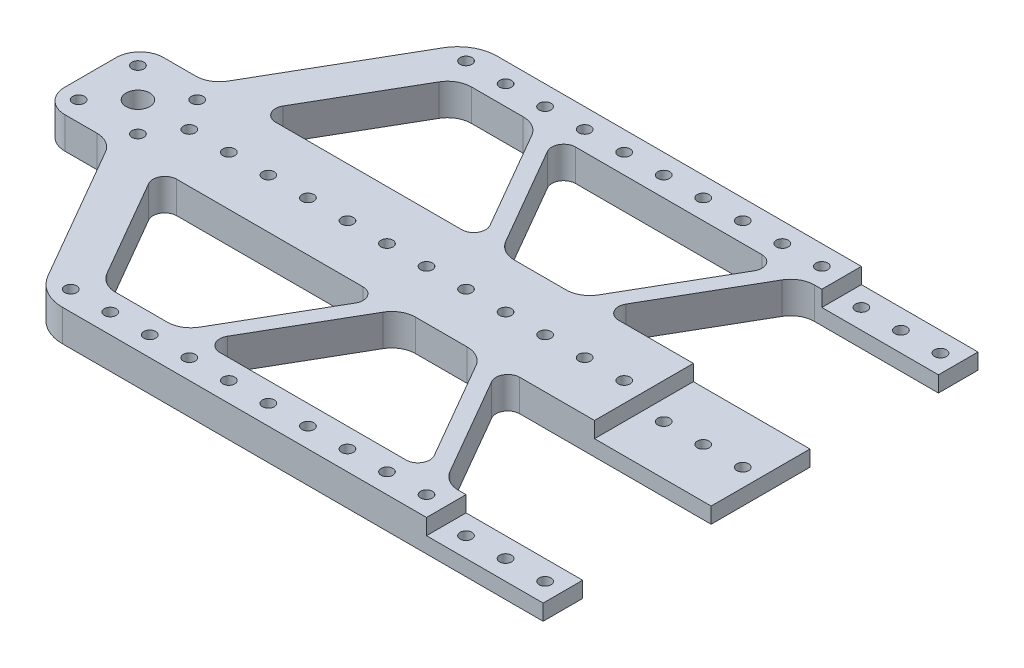
from build123d import *

# Parameters (mm, degrees)
SKETCH1_R           = 1.5
SKETCH1_R_2         = 3
BOSS_EXTRUDE1_DEPTH = 4
BOSS_EXTRUDE2_START = 4
SKETCH1_4_R         = 1.5
SKETCH1_4_R_2       = 3
BOSS_EXTRUDE2_DEPTH = 4
FILLET1_R           = 6
FILLET2_R           = 6
FILLET3_R           = 3
FILLET4_R           = 10


with BuildPart() as part:
    # Sketch1 → Boss-Extrude1 (new body)
    with BuildSketch(Plane(origin=(0, 0, 0), x_dir=(1, 0, 0), z_dir=(0, 1, 0))):
        Polygon((-84.75, 12.5), (-84.75, -12.5), (-67.174137787, -12.5), (-42.636751346, -55), (84.75, -55), (84.75, -45), (49.90212315, -45), (31.138239402, -12.5), (84.75, -12.5), (84.75, 12.5), (31.138239402, 12.5), (49.90212315, 45), (84.75, 45), (84.75, 55), (-42.636751346, 55), (-67.174137787, 12.5), align=None)
        Polygon((1.900635095, 12.5), (-55.627132403, 12.5), (-36.863248654, 45), (-16.863248654, 45), align=None, mode=Mode.SUBTRACT)
        Polygon((26.519437248, 12.5), (6.519437248, 12.5), (-12.244446501, 45), (45.283320997, 45), align=None, mode=Mode.SUBTRACT)
        Polygon((6.519437248, -12.5), (26.519437248, -12.5), (45.283320997, -45), (-12.244446501, -45), align=None, mode=Mode.SUBTRACT)
        Polygon((-55.627132403, -12.5), (1.900635095, -12.5), (-16.863248654, -45), (-36.863248654, -45), align=None, mode=Mode.SUBTRACT)
        with Locations((-80.25, -7.5)):
            Circle(SKETCH1_R, mode=Mode.SUBTRACT)
        with Locations((-65.25, -7.5)):
            Circle(SKETCH1_R, mode=Mode.SUBTRACT)
        with Locations((-59.75, 0)):
            Circle(SKETCH1_R, mode=Mode.SUBTRACT)
        with Locations((-49.75, 0)):
            Circle(SKETCH1_R, mode=Mode.SUBTRACT)
        with Locations((-39.75, 0)):
            Circle(SKETCH1_R, mode=Mode.SUBTRACT)
        with Locations((-29.75, 0)):
            Circle(SKETCH1_R, mode=Mode.SUBTRACT)
        with Locations((-19.75, 0)):
            Circle(SKETCH1_R, mode=Mode.SUBTRACT)
        with Locations((-9.75, 0)):
            Circle(SKETCH1_R, mode=Mode.SUBTRACT)
        with Locations((0.25, 0)):
            Circle(SKETCH1_R, mode=Mode.SUBTRACT)
        with Locations((10.25, 0)):
            Circle(SKETCH1_R, mode=Mode.SUBTRACT)
        with Locations((20.25, 0)):
            Circle(SKETCH1_R, mode=Mode.SUBTRACT)
        with Locations((30.25, 0)):
            Circle(SKETCH1_R, mode=Mode.SUBTRACT)
        with Locations((40.25, 0)):
            Circle(SKETCH1_R, mode=Mode.SUBTRACT)
        with Locations((50.25, 0)):
            Circle(SKETCH1_R, mode=Mode.SUBTRACT)
        with Locations((-72.75, 0)):
            Circle(SKETCH1_R_2, mode=Mode.SUBTRACT)
        with Locations((-80.25, 7.5)):
            Circle(SKETCH1_R, mode=Mode.SUBTRACT)
        with Locations((-65.25, 7.5)):
            Circle(SKETCH1_R, mode=Mode.SUBTRACT)
        with Locations((50.25, 50)):
            Circle(SKETCH1_R, mode=Mode.SUBTRACT)
        with Locations((-39.75, 50)):
            Circle(SKETCH1_R, mode=Mode.SUBTRACT)
        with Locations((-29.75, 50)):
            Circle(SKETCH1_R, mode=Mode.SUBTRACT)
        with Locations((-19.75, 50)):
            Circle(SKETCH1_R, mode=Mode.SUBTRACT)
        with Locations((-9.75, 50)):
            Circle(SKETCH1_R, mode=Mode.SUBTRACT)
        with Locations((0.25, 50)):
            Circle(SKETCH1_R, mode=Mode.SUBTRACT)
        with Locations((10.25, 50)):
            Circle(SKETCH1_R, mode=Mode.SUBTRACT)
        with Locations((20.25, 50)):
            Circle(SKETCH1_R, mode=Mode.SUBTRACT)
        with Locations((30.25, 50)):
            Circle(SKETCH1_R, mode=Mode.SUBTRACT)
        with Locations((40.25, 50)):
            Circle(SKETCH1_R, mode=Mode.SUBTRACT)
        with Locations((80.25, 0)):
            Circle(SKETCH1_R, mode=Mode.SUBTRACT)
        with Locations((60.25, 0)):
            Circle(SKETCH1_R, mode=Mode.SUBTRACT)
        with Locations((70.25, 0)):
            Circle(SKETCH1_R, mode=Mode.SUBTRACT)
        with Locations((50.25, -50)):
            Circle(SKETCH1_R, mode=Mode.SUBTRACT)
        with Locations((30.25, -50)):
            Circle(SKETCH1_R, mode=Mode.SUBTRACT)
        with Locations((40.25, -50)):
            Circle(SKETCH1_R, mode=Mode.SUBTRACT)
        with Locations((-39.75, -50)):
            Circle(SKETCH1_R, mode=Mode.SUBTRACT)
        with Locations((-29.75, -50)):
            Circle(SKETCH1_R, mode=Mode.SUBTRACT)
        with Locations((-19.75, -50)):
            Circle(SKETCH1_R, mode=Mode.SUBTRACT)
        with Locations((-9.75, -50)):
            Circle(SKETCH1_R, mode=Mode.SUBTRACT)
        with Locations((0.25, -50)):
            Circle(SKETCH1_R, mode=Mode.SUBTRACT)
        with Locations((10.25, -50)):
            Circle(SKETCH1_R, mode=Mode.SUBTRACT)
        with Locations((20.25, -50)):
            Circle(SKETCH1_R, mode=Mode.SUBTRACT)
        with Locations((80.25, 50)):
            Circle(SKETCH1_R, mode=Mode.SUBTRACT)
        with Locations((60.25, 50)):
            Circle(SKETCH1_R, mode=Mode.SUBTRACT)
        with Locations((70.25, 50)):
            Circle(SKETCH1_R, mode=Mode.SUBTRACT)
        with Locations((80.25, -50)):
            Circle(SKETCH1_R, mode=Mode.SUBTRACT)
        with Locations((60.25, -50)):
            Circle(SKETCH1_R, mode=Mode.SUBTRACT)
        with Locations((70.25, -50)):
            Circle(SKETCH1_R, mode=Mode.SUBTRACT)
    extrude(amount=-BOSS_EXTRUDE1_DEPTH)

    # Sketch1<4> → Boss-Extrude2 (add)
    with BuildSketch(Plane(origin=(0, 0, 0), x_dir=(1, 0, 0), z_dir=(0, 1, 0)).offset(BOSS_EXTRUDE2_START)):
        Polygon((-84.75, 12.5), (-84.75, -12.5), (-67.174137787, -12.5), (-42.636751346, -55), (55.25, -55), (55.25, -45), (49.90212315, -45), (31.138239402, -12.5), (55.25, -12.5), (55.25, 12.5), (31.138239402, 12.5), (49.90212315, 45), (55.25, 45), (55.25, 55), (-42.636751346, 55), (-67.174137787, 12.5), align=None)
        Polygon((1.900635095, 12.5), (-55.627132403, 12.5), (-36.863248654, 45), (-16.863248654, 45), align=None, mode=Mode.SUBTRACT)
        Polygon((26.519437248, 12.5), (6.519437248, 12.5), (-12.244446501, 45), (45.283320997, 45), align=None, mode=Mode.SUBTRACT)
        Polygon((6.519437248, -12.5), (26.519437248, -12.5), (45.283320997, -45), (-12.244446501, -45), align=None, mode=Mode.SUBTRACT)
        Polygon((-55.627132403, -12.5), (1.900635095, -12.5), (-16.863248654, -45), (-36.863248654, -45), align=None, mode=Mode.SUBTRACT)
        with Locations((-80.25, -7.5)):
            Circle(SKETCH1_4_R, mode=Mode.SUBTRACT)
        with Locations((-65.25, -7.5)):
            Circle(SKETCH1_4_R, mode=Mode.SUBTRACT)
        with Locations((-59.75, 0)):
            Circle(SKETCH1_4_R, mode=Mode.SUBTRACT)
        with Locations((-49.75, 0)):
            Circle(SKETCH1_4_R, mode=Mode.SUBTRACT)
        with Locations((-39.75, 0)):
            Circle(SKETCH1_4_R, mode=Mode.SUBTRACT)
        with Locations((-29.75, 0)):
            Circle(SKETCH1_4_R, mode=Mode.SUBTRACT)
        with Locations((-19.75, 0)):
            Circle(SKETCH1_4_R, mode=Mode.SUBTRACT)
        with Locations((-9.75, 0)):
            Circle(SKETCH1_4_R, mode=Mode.SUBTRACT)
        with Locations((0.25, 0)):
            Circle(SKETCH1_4_R, mode=Mode.SUBTRACT)
        with Locations((10.25, 0)):
            Circle(SKETCH1_4_R, mode=Mode.SUBTRACT)
        with Locations((20.25, 0)):
            Circle(SKETCH1_4_R, mode=Mode.SUBTRACT)
        with Locations((30.25, 0)):
            Circle(SKETCH1_4_R, mode=Mode.SUBTRACT)
        with Locations((40.25, 0)):
            Circle(SKETCH1_4_R, mode=Mode.SUBTRACT)
        with Locations((50.25, 0)):
            Circle(SKETCH1_4_R, mode=Mode.SUBTRACT)
        with Locations((-72.75, 0)):
            Circle(SKETCH1_4_R_2, mode=Mode.SUBTRACT)
        with Locations((-80.25, 7.5)):
            Circle(SKETCH1_4_R, mode=Mode.SUBTRACT)
        with Locations((-65.25, 7.5)):
            Circle(SKETCH1_4_R, mode=Mode.SUBTRACT)
        with Locations((50.25, 50)):
            Circle(SKETCH1_4_R, mode=Mode.SUBTRACT)
        with Locations((-39.75, 50)):
            Circle(SKETCH1_4_R, mode=Mode.SUBTRACT)
        with Locations((-29.75, 50)):
            Circle(SKETCH1_4_R, mode=Mode.SUBTRACT)
        with Locations((-19.75, 50)):
            Circle(SKETCH1_4_R, mode=Mode.SUBTRACT)
        with Locations((-9.75, 50)):
            Circle(SKETCH1_4_R, mode=Mode.SUBTRACT)
        with Locations((0.25, 50)):
            Circle(SKETCH1_4_R, mode=Mode.SUBTRACT)
        with Locations((10.25, 50)):
            Circle(SKETCH1_4_R, mode=Mode.SUBTRACT)
        with Locations((20.25, 50)):
            Circle(SKETCH1_4_R, mode=Mode.SUBTRACT)
        with Locations((30.25, 50)):
            Circle(SKETCH1_4_R, mode=Mode.SUBTRACT)
        with Locations((40.25, 50)):
            Circle(SKETCH1_4_R, mode=Mode.SUBTRACT)
        with Locations((50.25, -50)):
            Circle(SKETCH1_4_R, mode=Mode.SUBTRACT)
        with Locations((30.25, -50)):
            Circle(SKETCH1_4_R, mode=Mode.SUBTRACT)
        with Locations((40.25, -50)):
            Circle(SKETCH1_4_R, mode=Mode.SUBTRACT)
        with Locations((-39.75, -50)):
            Circle(SKETCH1_4_R, mode=Mode.SUBTRACT)
        with Locations((-29.75, -50)):
            Circle(SKETCH1_4_R, mode=Mode.SUBTRACT)
        with Locations((-19.75, -50)):
            Circle(SKETCH1_4_R, mode=Mode.SUBTRACT)
        with Locations((-9.75, -50)):
            Circle(SKETCH1_4_R, mode=Mode.SUBTRACT)
        with Locations((0.25, -50)):
            Circle(SKETCH1_4_R, mode=Mode.SUBTRACT)
        with Locations((10.25, -50)):
            Circle(SKETCH1_4_R, mode=Mode.SUBTRACT)
        with Locations((20.25, -50)):
            Circle(SKETCH1_4_R, mode=Mode.SUBTRACT)
    extrude(amount=-BOSS_EXTRUDE2_DEPTH)

    # Fillet1
    fillet1_edges = [part.edges().sort_by_distance(p)[0] for p in [
        (-84.75, 0, -12.5),
        (-84.75, 0, 12.5),
    ]]
    fillet(fillet1_edges, radius=FILLET1_R)

    # Fillet2
    fillet2_edges = [part.edges().sort_by_distance(p)[0] for p in [
        (26.519437248, 0, 12.5),
        (6.519437248, 0, 12.5),
        (26.519437248, 0, -12.5),
        (6.519437248, 0, -12.5),
        (-67.174137787, 0, -12.5),
        (-67.174137787, 0, 12.5),
        (-36.863248654, 0, 45),
        (-16.863248654, 0, 45),
        (49.90212315, 0, 45),
        (49.90212315, 0, -45),
        (-16.863248654, 0, -45),
        (-36.863248654, 0, -45),
    ]]
    fillet(fillet2_edges, radius=FILLET2_R)

    # Fillet3
    fillet3_edges = [part.edges().sort_by_distance(p)[0] for p in [
        (-55.627132403, 0, -12.5),
        (-12.244446501, 0, -45),
        (45.283320997, 0, -45),
        (31.138239402, 0, -12.5),
        (1.900635095, 0, -12.5),
        (-55.627132403, 0, 12.5),
        (-12.244446501, 0, 45),
        (45.283320997, 0, 45),
        (31.138239402, 0, 12.5),
        (1.900635095, 0, 12.5),
    ]]
    fillet(fillet3_edges, radius=FILLET3_R)

    # Fillet4
    fillet4_edges = [part.edges().sort_by_distance(p)[0] for p in [
        (-42.636751346, 0, 55),
        (-42.636751346, 0, -55),
    ]]
    fillet(fillet4_edges, radius=FILLET4_R)


solid = part.part
